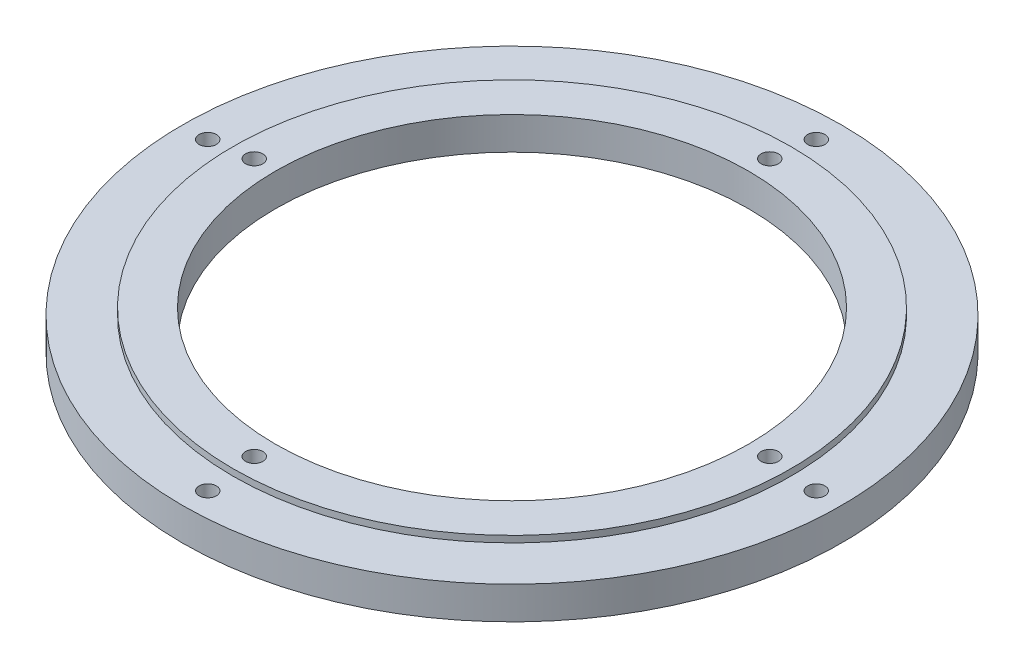
from build123d import *

# Parameters (mm, degrees)
SKETCH_1_R      = 85.5
SKETCH_1_R_2    = 72.5
SKETCH_1_R_3    = 2.65
EXTRUDE_2_DEPTH = 10
SKETCH_2_R      = 101
SKETCH_2_R_2    = 85.5
SKETCH_2_R_3    = 2.65
EXTRUDE_3_DEPTH = 10


with BuildPart() as part:
    # 草图1 → 凸台-拉伸2 (new body)
    with BuildSketch(Plane(origin=(0, 0, 0), x_dir=(1, 0, 0), z_dir=(0, 1, 0))):
        with Locations(Location((0, 0, 0), (0, 0, 270))):
            Circle(SKETCH_1_R)
        with Locations(Location((0, 0, 0), (0, 0, 270))):
            Circle(SKETCH_1_R_2, mode=Mode.SUBTRACT)
        with Locations(Location((0, 79, 0), (0, 0, 270))):
            Circle(SKETCH_1_R_3, mode=Mode.SUBTRACT)
        with Locations(Location((79, 0, 0), (0, 0, 270))):
            Circle(SKETCH_1_R_3, mode=Mode.SUBTRACT)
        with Locations(Location((0, -79, 0), (0, 0, 270))):
            Circle(SKETCH_1_R_3, mode=Mode.SUBTRACT)
        with Locations(Location((-79, 0, 0), (0, 0, 270))):
            Circle(SKETCH_1_R_3, mode=Mode.SUBTRACT)
    extrude(amount=EXTRUDE_2_DEPTH)

    # 草图2 → 凸台-拉伸3 (add)
    with BuildSketch(Plane(origin=(0, -2, 0), x_dir=(-1, 0, 0), z_dir=(0, -1, 0))):
        with Locations(Location((0, 0, 0), (0, 0, 90))):
            Circle(SKETCH_2_R)
        with Locations(Location((0, 0, 0), (0, 0, 90))):
            Circle(SKETCH_2_R_2, mode=Mode.SUBTRACT)
        with Locations(Location((0, 93.25, 0), (0, 0, 90))):
            Circle(SKETCH_2_R_3, mode=Mode.SUBTRACT)
        with Locations(Location((93.25, 0, 0), (0, 0, 90))):
            Circle(SKETCH_2_R_3, mode=Mode.SUBTRACT)
        with Locations(Location((0, -93.25, 0), (0, 0, 90))):
            Circle(SKETCH_2_R_3, mode=Mode.SUBTRACT)
        with Locations(Location((-93.25, 0, 0), (0, 0, 90))):
            Circle(SKETCH_2_R_3, mode=Mode.SUBTRACT)
    extrude(amount=-EXTRUDE_3_DEPTH)


solid = part.part
